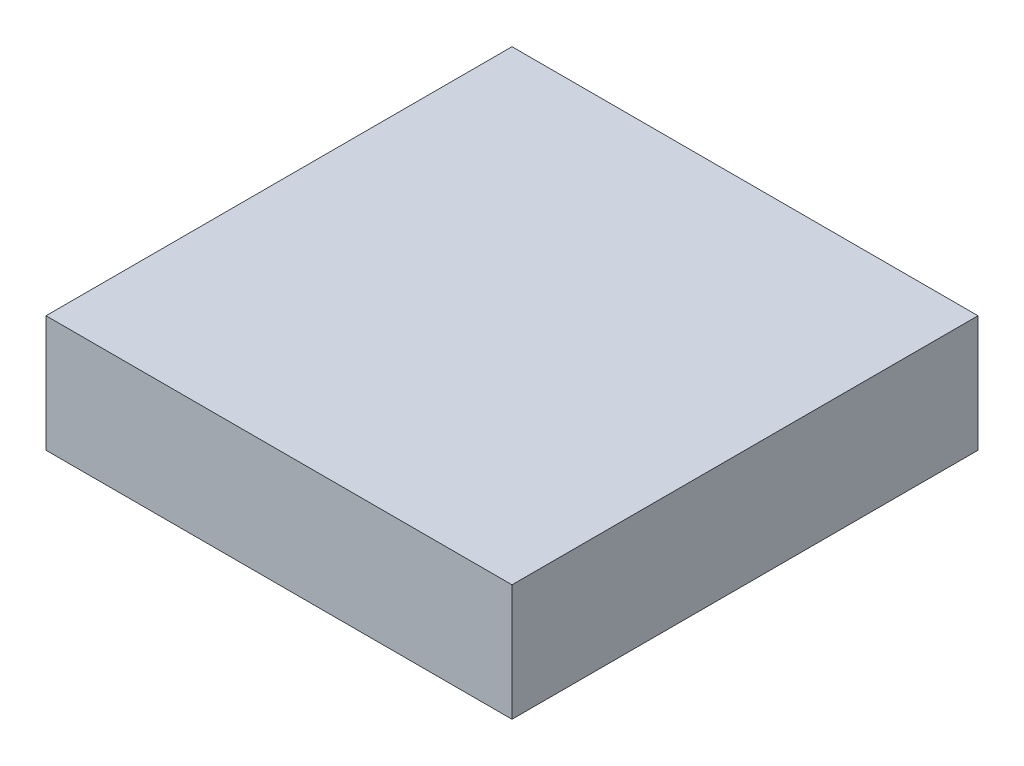
from build123d import *

# Parameters (mm, degrees)
SKETCH1_W           = 3
SKETCH1_H           = 3
BOSS_EXTRUDE1_DEPTH = 0.75


with BuildPart() as part:
    # Sketch1 → Boss-Extrude1 (new body)
    with BuildSketch(Plane(origin=(0, 0, 0), x_dir=(1, 0, 0), z_dir=(0, 1, 0))):
        with Locations((1.5, 1.5)):
            Rectangle(SKETCH1_W, SKETCH1_H)
    extrude(amount=BOSS_EXTRUDE1_DEPTH)


solid = part.part
